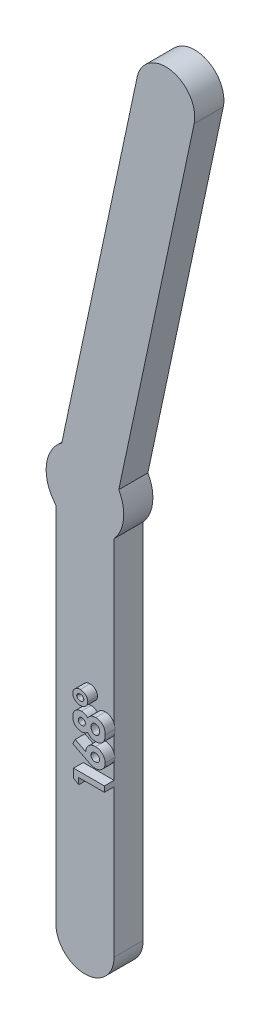
from build123d import *

# Parameters (mm, degrees)
BOSS_EXTRUDE1_DEPTH = 3
BOSS_EXTRUDE2_DEPTH = 1


with BuildPart() as part:
    # Sketch2 → Boss-Extrude1 (new body)
    with BuildSketch(Plane.XY):
        with BuildLine():
            Line((-3, -40), (-3, -2.645751311))
            ThreePointArc((-3, -2.645751311), (-3.978087581, 0.418113853), (-2.384360174, 3.21167037))
            Line((-2.384360174, 3.21167037), (5.382024831, 39.749639102))
            ThreePointArc((5.382024831, 39.749639102), (8.940202705, 42.060346832), (11.250910435, 38.502168957))
            Line((11.250910435, 38.502168957), (3.484525431, 1.964200225))
            ThreePointArc((3.484525431, 1.964200225), (3.978087581, -0.418113853), (3, -2.645751311))
            Line((3, -2.645751311), (3, -40))
            ThreePointArc((3, -40), (0, -43), (-3, -40))
        make_face()
    extrude(amount=BOSS_EXTRUDE1_DEPTH)

    # Sketch3 → Boss-Extrude2 (add)
    # profile 1 of 4: a face of its own
    with BuildSketch(Plane.XY.offset(3)):
        Polygon((-0.175, -25.093824173), (-0.175, -24.212939758), (3, -24.212939758), (3, -24.782811553), (0.354166667, -24.782811553), (0.354166667, -25.434093604), align=None)
    # profile 2 of 4: a face of its own
    with BuildSketch(Plane.XY.offset(3)):
        with BuildLine():
            Line((-0.256410256, -22.068288316), (-0.00073117, -21.563926337))
            Line((-0.00073117, -21.563926337), (1.086858974, -22.117261673))
            add(Edge.make_bspline(
                [(1.086858974, -22.117261673), (1.087699182, -22.084568744), (1.08935411, -22.020174658), (1.102916061, -21.925473131), (1.125900629, -21.834706792), (1.157976857, -21.747879393), (1.198275476, -21.66437083), (1.247870351, -21.584586499), (1.307937898, -21.509588736), (1.374612154, -21.43797837), (1.448443717, -21.372850049), (1.527786996, -21.316278065), (1.610700969, -21.266975665), (1.699043428, -21.228650184), (1.791349257, -21.197735515), (1.887987642, -21.175429235), (1.989238373, -21.162702875), (2.058022583, -21.160948334), (2.093038862, -21.160055143)],
                knots=[0, 0, 0, 0, 1.013301021, 1.995862538, 2.958769729, 3.911210226, 4.860765807, 5.829243184, 6.816804824, 7.835209597, 8.859810738, 9.863084768, 10.852896952, 11.844649668, 12.842374562, 13.8676291, 14.914464604, 16, 16, 16, 16], degree=3))
            add(Edge.make_bspline(
                [(2.093038862, -21.160055143), (2.126791471, -21.160894694), (2.193505906, -21.162554127), (2.291509072, -21.176192883), (2.385668521, -21.19847448), (2.475706102, -21.229599243), (2.561615653, -21.270258576), (2.643865413, -21.319128166), (2.721817332, -21.377620536), (2.794986541, -21.443914333), (2.861675605, -21.516398395), (2.920954086, -21.59279705), (2.969920028, -21.673761912), (3.011273002, -21.757761564), (3.042131258, -21.846342775), (3.065423901, -21.938179849), (3.078864766, -22.033969233), (3.08055497, -22.098988612), (3.081410256, -22.131890079)],
                knots=[0, 0, 0, 0, 1.049918105, 2.075237872, 3.072085611, 4.056810501, 5.033614955, 6.024683311, 7.028730171, 8.060902963, 9.092654048, 10.090156417, 11.064284078, 12.032024683, 12.998077465, 13.977262554, 14.976443176, 16, 16, 16, 16], degree=3))
            add(Edge.make_bspline(
                [(3.081410256, -22.131890079), (3.080702115, -22.166292579), (3.079309651, -22.233940442), (3.063944465, -22.332967886), (3.040371244, -22.427713118), (3.00835476, -22.518562131), (2.964898956, -22.604383282), (2.912827139, -22.68590899), (2.850939491, -22.76281363), (2.781089188, -22.834596166), (2.704544839, -22.89925371), (2.625080288, -22.95692632), (2.542560563, -23.005716559), (2.457076545, -23.045211336), (2.368899947, -23.076026022), (2.277863596, -23.097466771), (2.184208919, -23.111437395), (2.120649557, -23.113075132), (2.088586739, -23.113901297)],
                knots=[0, 0, 0, 0, 1.063729824, 2.091680771, 3.092458079, 4.082252707, 5.065066109, 6.062289472, 7.070414589, 8.114214813, 9.156632944, 10.167081891, 11.149282074, 12.117871028, 13.076366051, 14.034232288, 15.008359245, 16, 16, 16, 16], degree=3))
            add(Edge.make_bspline(
                [(2.088586739, -23.113901297), (2.06375783, -23.113464783), (2.013961804, -23.112589327), (1.93939508, -23.103790963), (1.864632145, -23.090415629), (1.801546371, -23.074907862), (1.748196903, -23.058949237), (1.703061639, -23.042854823), (1.653094195, -23.023125708), (1.598113094, -22.999875437), (1.537685209, -22.974068287), (1.47251918, -22.944067928), (1.40209523, -22.910851344), (1.353741684, -22.887123005), (1.328545673, -22.874758668)],
                knots=[0, 0, 0, 0, 1.110459156, 2.227099586, 3.354645278, 4.50724841, 5.131424341, 5.845429508, 6.650417918, 7.534765369, 8.5162346, 9.590157747, 10.744282107, 12, 12, 12, 12], degree=3))
            Line((1.328545673, -22.874758668), (-0.256410256, -22.068288316))
        make_face()
        with BuildLine():
            add(Edge.make_bspline(
                [(1.616025641, -22.144610431), (1.617282404, -22.171952347), (1.619741725, -22.225456886), (1.645408735, -22.301570812), (1.685796296, -22.370692762), (1.741267198, -22.431234804), (1.808539686, -22.481500396), (1.885422396, -22.518151909), (1.970520933, -22.540553237), (2.029932249, -22.542845945), (2.060601963, -22.544029502)],
                knots=[0, 0, 0, 0, 0.981531227, 1.92072777, 2.858278205, 3.847411092, 4.856727683, 5.864107753, 6.897395173, 8, 8, 8, 8], degree=3))
            add(Edge.make_bspline(
                [(2.060601963, -22.544029502), (2.091274551, -22.542609061), (2.150934785, -22.53984621), (2.236571866, -22.51694834), (2.314513622, -22.478867873), (2.382348334, -22.425874406), (2.439478332, -22.364100411), (2.481157755, -22.294901521), (2.506835747, -22.220355619), (2.509960066, -22.168765524), (2.511538462, -22.142702378)],
                knots=[0, 0, 0, 0, 1.098517379, 2.136689732, 3.153260427, 4.188757218, 5.205896274, 6.153740673, 7.067275863, 8, 8, 8, 8], degree=3))
            add(Edge.make_bspline(
                [(2.511538462, -22.142702378), (2.509929542, -22.11517904), (2.50677417, -22.061200992), (2.482210268, -21.983331742), (2.441163532, -21.912207265), (2.384914628, -21.849281956), (2.317789624, -21.795494127), (2.239264767, -21.757612874), (2.152720293, -21.733876198), (2.091926642, -21.731269877), (2.060601963, -21.729926938)],
                knots=[0, 0, 0, 0, 0.969156912, 1.90068503, 2.84824055, 3.843957741, 4.860802806, 5.860356532, 6.897522282, 8, 8, 8, 8], degree=3))
            add(Edge.make_bspline(
                [(2.060601963, -21.729926938), (2.029949922, -21.731408743), (1.970588665, -21.734278433), (1.885096174, -21.756135133), (1.808500745, -21.794543355), (1.740985819, -21.845953494), (1.685552061, -21.908561825), (1.645088829, -21.980459381), (1.619787825, -22.060049963), (1.617297987, -22.116012643), (1.616025641, -22.144610431)],
                knots=[0, 0, 0, 0, 1.082993585, 2.097343529, 3.092828129, 4.092676255, 5.080456977, 6.026823306, 6.991676418, 8, 8, 8, 8], degree=3))
        make_face(mode=Mode.SUBTRACT)
    # profile 3 of 4: a face of its own
    with BuildSketch(Plane.XY.offset(3)):
        with BuildLine():
            add(Edge.make_bspline(
                [(1.290384615, -18.989962995), (1.314166509, -18.956659672), (1.361240621, -18.890738748), (1.445595377, -18.803963081), (1.539140341, -18.728558932), (1.642399085, -18.666705625), (1.752431528, -18.616745081), (1.868089089, -18.581387356), (1.988052111, -18.558628476), (2.069615292, -18.556169837), (2.110847356, -18.554926938)],
                knots=[0, 0, 0, 0, 1.013621193, 2.006371702, 2.99000395, 3.985409788, 4.983103806, 5.979189713, 6.978433935, 8, 8, 8, 8], degree=3))
            add(Edge.make_bspline(
                [(2.110847356, -18.554926938), (2.155493061, -18.556432195), (2.244042089, -18.55941768), (2.373883227, -18.585879059), (2.498505826, -18.628139773), (2.616432852, -18.686441462), (2.724431839, -18.759194687), (2.820760825, -18.843527641), (2.901500204, -18.940706596), (2.956541404, -19.030829799), (2.992613836, -19.108697591), (3.017147677, -19.170934225), (3.036374539, -19.237531874), (3.053202037, -19.307498076), (3.065563353, -19.381707452), (3.075401317, -19.459537485), (3.080155908, -19.541542945), (3.08098502, -19.597355389), (3.081410256, -19.625980623)],
                knots=[0, 0, 0, 0, 1.313695232, 2.605545886, 3.885009818, 5.18064216, 6.467307036, 7.710187626, 8.938110693, 10.173834898, 10.807905002, 11.46418112, 12.141763502, 12.847499418, 13.582459421, 14.356129027, 15.156887083, 16, 16, 16, 16], degree=3))
            add(Edge.make_bspline(
                [(3.081410256, -19.625980623), (3.080993787, -19.656514493), (3.080180505, -19.71614112), (3.075321583, -19.803191664), (3.066194522, -19.885273069), (3.054699341, -19.962752088), (3.037672832, -20.034935992), (3.018972292, -20.102914275), (2.996206942, -20.165961692), (2.960636755, -20.242673866), (2.907185797, -20.331143905), (2.828023569, -20.42602139), (2.734597618, -20.510356273), (2.627697323, -20.582164983), (2.509788283, -20.640081434), (2.383511061, -20.682445207), (2.249446964, -20.70772534), (2.157597072, -20.710756125), (2.110847356, -20.712298732)],
                knots=[0, 0, 0, 0, 0.887120363, 1.732371145, 2.531576131, 3.285973923, 4.006155245, 4.684676743, 5.333503306, 5.950809733, 7.13915648, 8.324434623, 9.528022799, 10.783613014, 12.053458699, 13.333110172, 14.642607612, 16, 16, 16, 16], degree=3))
            add(Edge.make_bspline(
                [(2.110847356, -20.712298732), (2.070068436, -20.710883845), (1.989932921, -20.70810342), (1.872494733, -20.688245124), (1.761018818, -20.653978668), (1.654672452, -20.607478654), (1.553870674, -20.54716871), (1.459741575, -20.47252822), (1.370281849, -20.385578139), (1.317458785, -20.319433151), (1.290384615, -20.285530904)],
                knots=[0, 0, 0, 0, 1.018125035, 2.000738969, 2.963689272, 3.92372463, 4.892478514, 5.887985778, 6.917498794, 8, 8, 8, 8], degree=3))
            add(Edge.make_bspline(
                [(1.290384615, -20.285530904), (1.266151716, -20.30654453), (1.218444435, -20.347914033), (1.141646952, -20.401412926), (1.062364505, -20.446707636), (0.981097768, -20.484676112), (0.89711666, -20.513031338), (0.811521784, -20.534606137), (0.723184578, -20.546616471), (0.663516636, -20.54851784), (0.633378405, -20.54947822)],
                knots=[0, 0, 0, 0, 1.061588578, 2.089948196, 3.093099862, 4.082597858, 5.055037947, 6.023898163, 7.001872498, 8, 8, 8, 8], degree=3))
            add(Edge.make_bspline(
                [(0.633378405, -20.54947822), (0.592576327, -20.548218116), (0.512075397, -20.545731982), (0.394207452, -20.523449718), (0.28205246, -20.486963897), (0.176290436, -20.436734302), (0.079075037, -20.373530164), (-0.007396026, -20.297386274), (-0.081993722, -20.209583642), (-0.145475268, -20.111270335), (-0.195029291, -20.002567713), (-0.230531324, -19.885149843), (-0.252811348, -19.759751044), (-0.25519237, -19.673353032), (-0.256410256, -19.629160712)],
                knots=[0, 0, 0, 0, 1.02226196, 2.016883474, 2.9952073, 3.972418565, 4.944004294, 5.893096802, 6.850754418, 7.823909284, 8.818133006, 9.835407617, 10.892817559, 12, 12, 12, 12], degree=3))
            add(Edge.make_bspline(
                [(-0.256410256, -19.629160712), (-0.255190422, -19.58560497), (-0.252812, -19.500680393), (-0.230679106, -19.377484091), (-0.194395909, -19.26261264), (-0.143773179, -19.156310354), (-0.08015754, -19.059019848), (-0.003012872, -18.972719635), (0.085649386, -18.896811649), (0.185372183, -18.83308275), (0.292865784, -18.781836025), (0.405795355, -18.74439097), (0.522920147, -18.722433033), (0.602336048, -18.719315557), (0.642282652, -18.71774745)],
                knots=[0, 0, 0, 0, 1.094451292, 2.133950859, 3.135435022, 4.115505557, 5.085475983, 6.048403322, 7.01637925, 8.011600517, 9.015508126, 10.003420448, 10.995710276, 12, 12, 12, 12], degree=3))
            add(Edge.make_bspline(
                [(0.642282652, -18.71774745), (0.670513068, -18.718506145), (0.725913147, -18.719995027), (0.807533099, -18.73100352), (0.885847553, -18.749540472), (0.962749047, -18.775385179), (1.040327423, -18.811318145), (1.120069223, -18.859943803), (1.205287736, -18.91909053), (1.261061511, -18.96554141), (1.290384615, -18.989962995)],
                knots=[0, 0, 0, 0, 0.940746401, 1.846144481, 2.739104268, 3.619506754, 4.545839139, 5.581956076, 6.728711598, 8, 8, 8, 8], degree=3))
        make_face()
        with BuildLine():
            add(Edge.make_bspline(
                [(0.313461538, -19.643153099), (0.314577296, -19.666624017), (0.316747691, -19.712280136), (0.336791099, -19.777192221), (0.368396801, -19.836084013), (0.413289247, -19.88676556), (0.468001453, -19.927901292), (0.530415435, -19.958637917), (0.600152328, -19.976695698), (0.648960581, -19.978617315), (0.674083534, -19.979606425)],
                knots=[0, 0, 0, 0, 1.01773081, 1.979711282, 2.923920718, 3.903393177, 4.896680191, 5.881555186, 6.909578104, 8, 8, 8, 8], degree=3))
            add(Edge.make_bspline(
                [(0.674083534, -19.979606425), (0.699424417, -19.978389188), (0.748904934, -19.976012415), (0.819934691, -19.957291435), (0.884396564, -19.925458821), (0.940626067, -19.88139272), (0.987659679, -19.828873386), (1.021570733, -19.768524903), (1.04308292, -19.702472353), (1.045116089, -19.656040339), (1.046153846, -19.6323408)],
                knots=[0, 0, 0, 0, 1.070748338, 2.090739333, 3.08117878, 4.090911184, 5.094654374, 6.042199979, 7.000711936, 8, 8, 8, 8], degree=3))
            add(Edge.make_bspline(
                [(1.046153846, -19.6323408), (1.045059816, -19.608239732), (1.042928441, -19.561286331), (1.022508887, -19.494311553), (0.988689983, -19.434516202), (0.94229789, -19.383054122), (0.886359471, -19.340008241), (0.820898298, -19.309158453), (0.747532717, -19.291235712), (0.696233661, -19.28885422), (0.66963141, -19.287619245)],
                knots=[0, 0, 0, 0, 1.009150293, 1.966014103, 2.906107826, 3.870180916, 4.854078599, 5.848854597, 6.884476363, 8, 8, 8, 8], degree=3))
            add(Edge.make_bspline(
                [(0.66963141, -19.287619245), (0.644523092, -19.288888554), (0.595964488, -19.291343354), (0.526250213, -19.308945205), (0.464864053, -19.341271884), (0.410961323, -19.383744971), (0.367492124, -19.436994838), (0.335524613, -19.498814034), (0.316983147, -19.568747348), (0.314660828, -19.617814095), (0.313461538, -19.643153099)],
                knots=[0, 0, 0, 0, 1.065910571, 2.061433587, 3.023559535, 3.990682701, 4.956464619, 5.918590567, 6.925120432, 8, 8, 8, 8], degree=3))
        make_face(mode=Mode.SUBTRACT)
        with BuildLine():
            add(Edge.make_bspline(
                [(1.616025641, -19.624708588), (1.616315036, -19.64254073), (1.616885429, -19.677687657), (1.623711201, -19.729318951), (1.633401384, -19.779069221), (1.648498508, -19.826066767), (1.666134775, -19.871556653), (1.689165374, -19.914390589), (1.715918448, -19.955302486), (1.74640318, -19.993409541), (1.779830517, -20.027860175), (1.814702344, -20.058911473), (1.851910211, -20.084292188), (1.890219827, -20.105428102), (1.929934133, -20.122410971), (1.971707306, -20.133637921), (2.014983002, -20.140866508), (2.044460653, -20.141903734), (2.059329928, -20.142426938)],
                knots=[0, 0, 0, 0, 1.129662435, 2.226550525, 3.296682235, 4.33815786, 5.351414921, 6.385493299, 7.41431807, 8.4469981, 9.473537958, 10.454642902, 11.401552439, 12.321859429, 13.225429467, 14.131893492, 15.057679712, 16, 16, 16, 16], degree=3))
            add(Edge.make_bspline(
                [(2.059329928, -20.142426938), (2.074837113, -20.14217757), (2.105593696, -20.141682979), (2.150485415, -20.134212883), (2.193780386, -20.12345726), (2.235073386, -20.108350658), (2.274340207, -20.088148394), (2.311963245, -20.064026725), (2.347676229, -20.035143596), (2.381297203, -20.002285779), (2.411600958, -19.965490297), (2.438404735, -19.92587478), (2.461677906, -19.883697429), (2.479861546, -19.838557575), (2.49411916, -19.790634304), (2.503888336, -19.740135748), (2.510720881, -19.686798818), (2.511261264, -19.650384202), (2.511538462, -19.631704782)],
                knots=[0, 0, 0, 0, 0.973751152, 1.931314908, 2.852573969, 3.776047714, 4.688004804, 5.623328242, 6.580799242, 7.570383313, 8.573782212, 9.57185612, 10.573837789, 11.596003268, 12.62492379, 13.712263769, 14.826471634, 16, 16, 16, 16], degree=3))
            add(Edge.make_bspline(
                [(2.511538462, -19.631704782), (2.511196157, -19.612820326), (2.510529115, -19.5760205), (2.504633754, -19.522226535), (2.495279457, -19.47134707), (2.481900889, -19.423442519), (2.464761533, -19.378332997), (2.442949692, -19.336619065), (2.418219634, -19.297364903), (2.389368786, -19.26177186), (2.357892778, -19.229561291), (2.323956282, -19.201180401), (2.287463312, -19.177420805), (2.248401199, -19.158538643), (2.207627439, -19.143006366), (2.164524234, -19.132206583), (2.119106345, -19.125688101), (2.087973171, -19.125099678), (2.07205028, -19.124798732)],
                knots=[0, 0, 0, 0, 1.200550576, 2.339492856, 3.436821733, 4.486835684, 5.498320788, 6.499238723, 7.475334368, 8.44385928, 9.406737867, 10.335409062, 11.251568017, 12.168024507, 13.089524389, 14.021419298, 14.988065767, 16, 16, 16, 16], degree=3))
            add(Edge.make_bspline(
                [(2.07205028, -19.124798732), (2.056133401, -19.125380555), (2.025021417, -19.126517817), (1.979077259, -19.132740747), (1.935521469, -19.144414325), (1.893343926, -19.159686791), (1.853417246, -19.180002617), (1.81582637, -19.205224498), (1.779637539, -19.233932356), (1.746471676, -19.267488763), (1.716116677, -19.304165285), (1.689182565, -19.343246399), (1.666011589, -19.384331902), (1.64851655, -19.428430879), (1.633396343, -19.474143779), (1.62371115, -19.522634989), (1.616884013, -19.57299657), (1.616314611, -19.607299791), (1.616025641, -19.624708588)],
                knots=[0, 0, 0, 0, 1.011783362, 1.977685852, 2.938313235, 3.871729441, 4.823627117, 5.776382316, 6.744161804, 7.753880392, 8.768082256, 9.765777265, 10.766741032, 11.757408326, 12.775628261, 13.821889533, 14.89461443, 16, 16, 16, 16], degree=3))
        make_face(mode=Mode.SUBTRACT)
    # profile 4 of 4: a face of its own
    with BuildSketch(Plane.XY.offset(3)):
        with BuildLine():
            add(Edge.make_bspline(
                [(-0.256410256, -17.566555543), (-0.255930892, -17.542340731), (-0.254983941, -17.494506073), (-0.243514239, -17.424464846), (-0.226415069, -17.356862499), (-0.20220404, -17.291757834), (-0.17063406, -17.229365984), (-0.133314937, -17.168903502), (-0.087224204, -17.112490224), (-0.036359862, -17.057878171), (0.020262658, -17.008152697), (0.081127567, -16.964740504), (0.144964256, -16.927311481), (0.212959808, -16.897518001), (0.284048739, -16.873880311), (0.358663849, -16.85749903), (0.4365402, -16.846858745), (0.489814234, -16.845834155), (0.516987179, -16.845311553)],
                knots=[0, 0, 0, 0, 0.986183918, 1.948136961, 2.885113226, 3.82582866, 4.772756377, 5.7319101, 6.715857212, 7.73687142, 8.771835946, 9.781521548, 10.780610094, 11.782721834, 12.802125377, 13.829520645, 14.892925611, 16, 16, 16, 16], degree=3))
            add(Edge.make_bspline(
                [(0.516987179, -16.845311553), (0.54416234, -16.845826409), (0.597651074, -16.846839798), (0.675862738, -16.857677026), (0.750960868, -16.873147053), (0.822420789, -16.896092855), (0.890095339, -16.926173202), (0.954118424, -16.962767088), (1.014730947, -17.005421772), (1.071094286, -17.05430553), (1.122151647, -17.107818451), (1.166899434, -17.164809188), (1.205533371, -17.224151132), (1.236884237, -17.286587539), (1.260457271, -17.35226927), (1.277425482, -17.420456553), (1.288965573, -17.491328218), (1.289907715, -17.539584644), (1.290384615, -17.564011473)],
                knots=[0, 0, 0, 0, 1.10693925, 2.178782999, 3.212646578, 4.229248144, 5.231237557, 6.225896701, 7.230453938, 8.247422707, 9.262039081, 10.24050044, 11.19688608, 12.143698207, 13.081316995, 14.034926815, 15.00530332, 16, 16, 16, 16], degree=3))
            add(Edge.make_bspline(
                [(1.290384615, -17.564011473), (1.289895651, -17.587590591), (1.288925567, -17.634370505), (1.277486445, -17.702932767), (1.260396202, -17.76928094), (1.236113885, -17.833075009), (1.204733033, -17.89446477), (1.166287091, -17.953242639), (1.120826672, -18.009417767), (1.068961421, -18.062276351), (1.012474307, -18.111083212), (0.951361711, -18.153063654), (0.887875103, -18.189792652), (0.820361708, -18.21904952), (0.749720307, -18.242210931), (0.675428015, -18.257547057), (0.59829573, -18.268477602), (0.545648189, -18.269481107), (0.518895232, -18.26999104)],
                knots=[0, 0, 0, 0, 0.971824776, 1.928056815, 2.859364222, 3.79501494, 4.73771129, 5.698373031, 6.687324995, 7.71403889, 8.749987443, 9.761727899, 10.768465712, 11.771091887, 12.791715353, 13.829582059, 14.897097682, 16, 16, 16, 16], degree=3))
            add(Edge.make_bspline(
                [(0.518895232, -18.26999104), (0.491934598, -18.269468568), (0.43908352, -18.268444364), (0.361626675, -18.257777437), (0.287542504, -18.241334772), (0.216451869, -18.21851581), (0.1488343, -18.188343508), (0.084337471, -18.151897957), (0.022868678, -18.109288224), (-0.033778302, -18.059759688), (-0.085376302, -18.006077725), (-0.131511315, -17.950359698), (-0.170368203, -17.891838026), (-0.200992934, -17.830669765), (-0.226771794, -17.768027391), (-0.243267707, -17.702667377), (-0.255032324, -17.635458181), (-0.255947058, -17.589717483), (-0.256410256, -17.566555543)],
                knots=[0, 0, 0, 0, 1.112535944, 2.180910215, 3.221491057, 4.242935454, 5.25790828, 6.273069816, 7.297809445, 8.340302986, 9.37412446, 10.369391641, 11.323506171, 12.266960772, 13.190220775, 14.113812676, 15.044882174, 16, 16, 16, 16], degree=3))
        make_face()
        with BuildLine():
            add(Edge.make_bspline(
                [(0.150641026, -17.560195367), (0.15186478, -17.58006437), (0.154288346, -17.619413638), (0.173850404, -17.676057561), (0.205007107, -17.72840339), (0.247902921, -17.775447289), (0.30128439, -17.815231339), (0.364986585, -17.843203281), (0.437262987, -17.859983458), (0.488269063, -17.861921221), (0.515079127, -17.862939758)],
                knots=[0, 0, 0, 0, 0.900062707, 1.782515652, 2.688525523, 3.649102582, 4.653734122, 5.687438757, 6.784460205, 8, 8, 8, 8], degree=3))
            add(Edge.make_bspline(
                [(0.515079127, -17.862939758), (0.542738548, -17.86193638), (0.595216582, -17.860032676), (0.669074036, -17.843263058), (0.733764146, -17.816071806), (0.787485844, -17.776702163), (0.830111271, -17.729921127), (0.860921866, -17.67750111), (0.880541803, -17.620500675), (0.882393732, -17.580493547), (0.883333333, -17.560195367)],
                knots=[0, 0, 0, 0, 1.241537348, 2.355560413, 3.38391081, 4.372980969, 5.324060443, 6.208065016, 7.090836524, 8, 8, 8, 8], degree=3))
            add(Edge.make_bspline(
                [(0.883333333, -17.560195367), (0.882013447, -17.539944319), (0.879404408, -17.499913763), (0.861404967, -17.44175838), (0.828586415, -17.38960419), (0.786210693, -17.341744814), (0.732587247, -17.301211921), (0.668016087, -17.272558375), (0.594422028, -17.255236863), (0.542316559, -17.253349453), (0.515079127, -17.252362835)],
                knots=[0, 0, 0, 0, 0.906223276, 1.791345334, 2.689438198, 3.643508222, 4.63962, 5.671282663, 6.782694334, 8, 8, 8, 8], degree=3))
            add(Edge.make_bspline(
                [(0.515079127, -17.252362835), (0.488073153, -17.253429841), (0.436472073, -17.2554686), (0.363281145, -17.271706179), (0.29964092, -17.300699157), (0.246539183, -17.340458104), (0.204271395, -17.387859512), (0.17286096, -17.440570342), (0.154366055, -17.49900928), (0.151900847, -17.539501956), (0.150641026, -17.560195367)],
                knots=[0, 0, 0, 0, 1.212996072, 2.317706084, 3.345104927, 4.332130606, 5.276819526, 6.182059372, 7.07095808, 8, 8, 8, 8], degree=3))
        make_face(mode=Mode.SUBTRACT)
    extrude(amount=BOSS_EXTRUDE2_DEPTH)


solid = part.part
